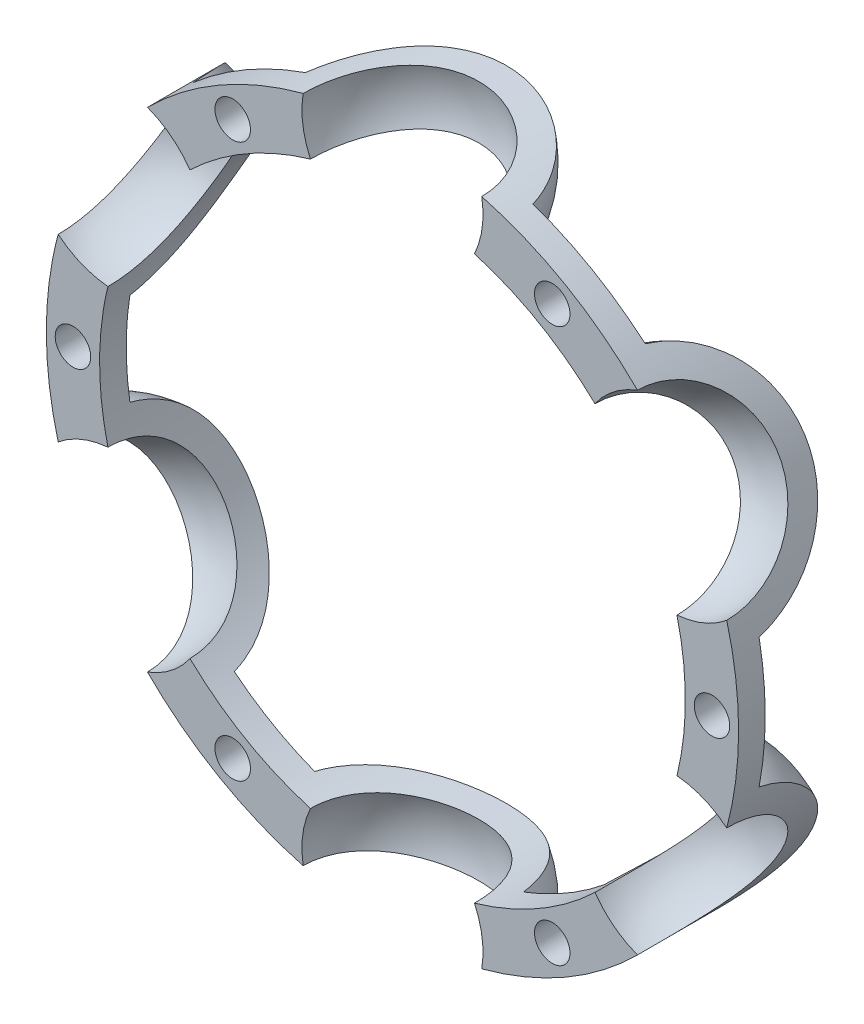
from build123d import *

# Parameters (mm, degrees)
SKETCH1_R           = 9.75
SKETCH1_R_2         = 8.25
BOSS_EXTRUDE1_DEPTH = 2.5
CIRPATTERN1_COUNT   = 6
SHELL1_T            = -0.75
SKETCH3_R           = 0.5
CUT_EXTRUDE2_DEPTH  = 15.177976016
CIRPATTERN2_COUNT   = 6


with BuildPart() as part:
    # Sketch1 → Boss-Extrude1 (new, symmetric)
    with BuildSketch(Plane.XY):
        Circle(SKETCH1_R)
        Circle(SKETCH1_R_2, mode=Mode.SUBTRACT)
    extrude(amount=BOSS_EXTRUDE1_DEPTH, both=True)

    # Sketch2 → Cut-Revolve1 (revolve, cut)
    with BuildSketch(Plane.XY.offset(2.5)):
        with BuildLine():
            Line((0, 6.45), (0, 11.55))
            ThreePointArc((0, 11.55), (2.55, 9), (0, 6.45))
        make_face()
    cut_revolve1 = revolve(axis=Axis((0, 0, 2.5), (0, 1, 0)), mode=Mode.SUBTRACT)

    # CirPattern1: Cut-Revolve1 ×6 about axis
    cirpattern1_axis = Axis((0, 0, 0), (0, 0, 1))
    for i in range(1, CIRPATTERN1_COUNT):
        add(cut_revolve1.rotate(cirpattern1_axis, i * 360 / CIRPATTERN1_COUNT), mode=Mode.SUBTRACT)

    # Shell1
    shell1_openings = [part.faces().sort_by_distance(p)[0] for p in [
        (-9.75, 0, 0),
        (-9.474228355, 0, -2.5),
        (-8.25, 0, 0),
    ]]
    offset(amount=SHELL1_T, openings=shell1_openings)

    # Sketch3 → Cut-Extrude2 (cut, through all)
    with BuildSketch(Plane.XY.offset(2.5)):
        with Locations((9, 0)):
            Circle(SKETCH3_R)
    cut_extrude2 = extrude(amount=-CUT_EXTRUDE2_DEPTH, mode=Mode.SUBTRACT)

    # CirPattern2: Cut-Extrude2 ×6 about axis
    cirpattern2_axis = Axis((0, 0, 0), (0, 0, 1))
    for i in range(1, CIRPATTERN2_COUNT):
        add(cut_extrude2.rotate(cirpattern2_axis, i * 360 / CIRPATTERN2_COUNT), mode=Mode.SUBTRACT)


solid = part.part
